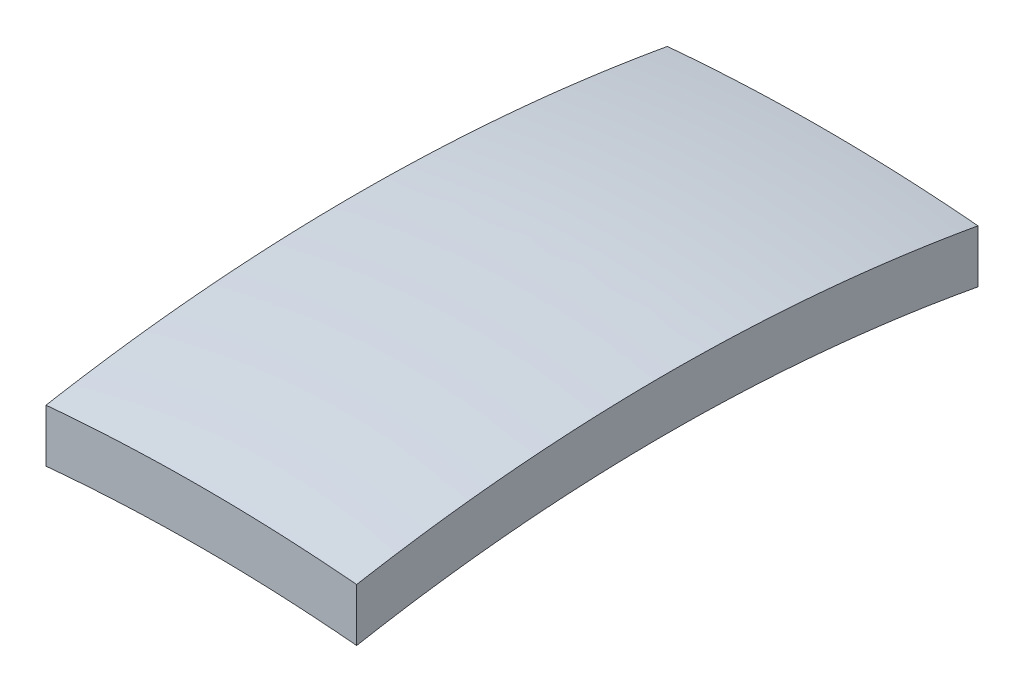
from build123d import *

# Parameters (mm, degrees)
CUT_EXTRUDE1_REACH = 361.264
SKETCH3_R          = 281.926885118
SKETCH3_W          = 60
SKETCH3_H          = 120


with BuildPart() as part:
    # Sketch2 → Revolve1 (revolve)
    with BuildSketch(Plane(origin=(0, 0, 0), x_dir=(0, 0, -1), z_dir=(1, 0, 0)), mode=Mode.PRIVATE) as revolve1_sk:
        with BuildLine():
            Line((242.5, 236.958329575), (242.5, 241.159179796))
            Line((242.5, 241.159179796), (238.5, 241.159179796))
            Line((238.5, 241.159179796), (238.5, 245.115788965))
            ThreePointArc((238.5, 245.115788965), (128.713635979, 316.854540622), (0, 342))
            Line((0, 342), (0, 332))
            ThreePointArc((0, 332), (126.922374282, 306.781210159), (234.562648062, 234.9560898))
            Line((234.562648062, 234.9560898), (242.5, 234.9560898))
            Line((242.5, 234.9560898), (242.5, 236.958329575))
        make_face()
    revolve(revolve1_sk.sketch.rotate(Axis((0, 342, 0), (0, -1, 0)), 180), axis=Axis((0, 342, 0), (0, -1, 0)))

    # Sketch3 → Cut-Extrude1 (cut, up to next)
    with BuildSketch(Plane.XZ.offset(-234.9560898), mode=Mode.PRIVATE) as cut_extrude1_sk1:
        Circle(SKETCH3_R)
        Rectangle(SKETCH3_W, SKETCH3_H, mode=Mode.SUBTRACT)
    cut_extrude1_tool1 = extrude(cut_extrude1_sk1.sketch, amount=-CUT_EXTRUDE1_REACH, mode=Mode.PRIVATE) & part.part
    add(cut_extrude1_tool1.solids().sort_by_distance((-273.952789, 234.95609, 0))[0], mode=Mode.SUBTRACT)


solid = part.part
